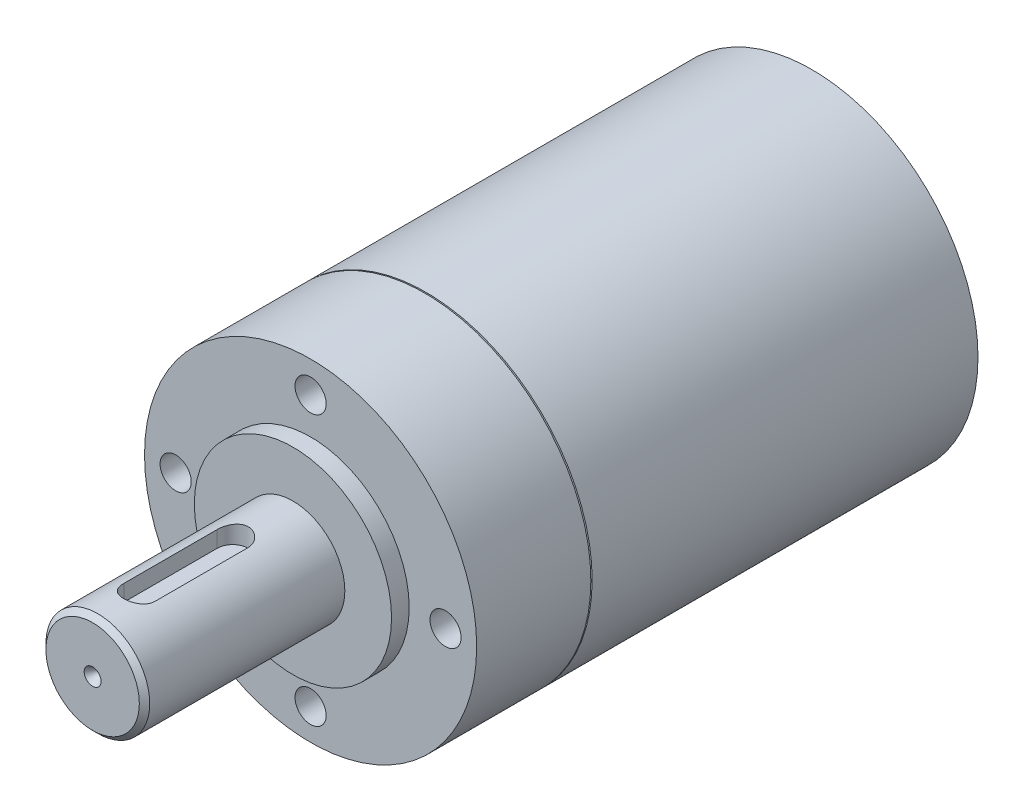
from build123d import *

# Parameters (mm, degrees)
SKETCH_8_R           = 16
EXTRUDE_1_DEPTH      = 48.3
SKETCH_9_R           = 9.5
EXTRUDE_2_DEPTH      = 1.7
SKETCH_10_R          = 5
EXTRUDE_3_DEPTH      = 19.3
CUT_EXTRUDE_8_DEPTH  = 3
SKETCH_13_R          = 1.5
CUT_EXTRUDE_9_DEPTH  = 6
SKETCH_14_R          = 8
CUT_EXTRUDE_10_DEPTH = 1.2
SKETCH_15_R          = 2.5
CUT_EXTRUDE_11_DEPTH = 20
SKETCH_16_R          = 1.5
CUT_EXTRUDE_12_DEPTH = 4
SKETCH_17_W          = 1.387391921
SKETCH_17_H          = 0.126778365
CHAMFER_1_SIZE       = 0.5


with BuildPart() as part:
    # 草图8 → 凸台-拉伸1 (new body)
    with BuildSketch(Plane.XY):
        with Locations(Location((0, 0, 0), (0, 0, 180))):
            Circle(SKETCH_8_R)
    extrude(amount=EXTRUDE_1_DEPTH)

    # 草图9 → 凸台-拉伸2 (add)
    with BuildSketch(Plane.XY.offset(48.3)):
        Circle(SKETCH_9_R)
    extrude(amount=EXTRUDE_2_DEPTH)

    # 草图10 → 凸台-拉伸3 (add)
    with BuildSketch(Plane.XY.offset(50)):
        Circle(SKETCH_10_R)
    extrude(amount=EXTRUDE_3_DEPTH)

    # 切除-拉伸7 cone 1 section (through the dimple's axis) → 切除-拉伸7 (revolve, cut)
    with BuildSketch(Plane(origin=(0, 0, 69.3), x_dir=(0, -1, 0), z_dir=(1, 0, 0))):
        Polygon((0, 0), (0.813334859, 0), (0, 1.301607858), align=None)
    revolve(axis=Axis((0, 0, 69.3), (0, 0, -1)), mode=Mode.SUBTRACT)

    # 草图12 → 切除-拉伸8 (cut)
    with BuildSketch(Plane(origin=(0, 3.2, 0), x_dir=(1, 0, 0), z_dir=(0, 1, 0))):
        with BuildLine():
            Line((-1.5, -64.8), (-1.5, -55.8))
            ThreePointArc((-1.5, -55.8), (0, -54.3), (1.5, -55.8))
            Line((1.5, -55.8), (1.5, -64.8))
            ThreePointArc((1.5, -64.8), (0, -66.3), (-1.5, -64.8))
        make_face()
    extrude(amount=CUT_EXTRUDE_8_DEPTH, mode=Mode.SUBTRACT)

    # 草图13 → 切除-拉伸9 (cut)
    with BuildSketch(Plane.XY.offset(48.3)):
        with Locations((0, 13)):
            Circle(SKETCH_13_R)
        with Locations((-13, 0)):
            Circle(SKETCH_13_R)
        with Locations((0, -13)):
            Circle(SKETCH_13_R)
        with Locations((13, 0)):
            Circle(SKETCH_13_R)
    extrude(amount=-CUT_EXTRUDE_9_DEPTH, mode=Mode.SUBTRACT)

    # 草图14 → 切除-拉伸10 (cut)
    with BuildSketch(Plane(origin=(0, 0, 0), x_dir=(-1, 0, 0), z_dir=(0, 0, -1))):
        Circle(SKETCH_14_R)
    extrude(amount=-CUT_EXTRUDE_10_DEPTH, mode=Mode.SUBTRACT)

    # 草图15 → 切除-拉伸11 (cut)
    with BuildSketch(Plane(origin=(0, 0, 0), x_dir=(-1, 0, 0), z_dir=(0, 0, -1))):
        Circle(SKETCH_15_R)
    extrude(amount=-CUT_EXTRUDE_11_DEPTH, mode=Mode.SUBTRACT)

    # 草图16 → 切除-拉伸12 (cut)
    with BuildSketch(Plane(origin=(0, 0, 0), x_dir=(-1, 0, 0), z_dir=(0, 0, -1))):
        with Locations((0, 11)):
            Circle(SKETCH_16_R)
        with Locations((11, 0)):
            Circle(SKETCH_16_R)
        with Locations((0, -11)):
            Circle(SKETCH_16_R)
        with Locations((-11, 0)):
            Circle(SKETCH_16_R)
    extrude(amount=-CUT_EXTRUDE_12_DEPTH, mode=Mode.SUBTRACT)

    # 草图17 → 切除-旋转1 (revolve, cut)
    with BuildSketch(Plane(origin=(0, 0, 0), x_dir=(1, 0, 0), z_dir=(0, 1, 0)), mode=Mode.PRIVATE) as cut_revolve_1_sk:
        with Locations((16.513931417, -37.236610818)):
            Rectangle(SKETCH_17_W, SKETCH_17_H)
    revolve(cut_revolve_1_sk.sketch.rotate(Axis((0, 0, 69.3), (0, 0, -1)), 180), axis=Axis((0, 0, 69.3), (0, 0, -1)), mode=Mode.SUBTRACT)

    # 倒角1
    chamfer_1_edges = [part.edges().sort_by_distance(p)[0] for p in [
        (-5, 0, 69.3),
    ]]
    chamfer(chamfer_1_edges, length=CHAMFER_1_SIZE)


solid = part.part
